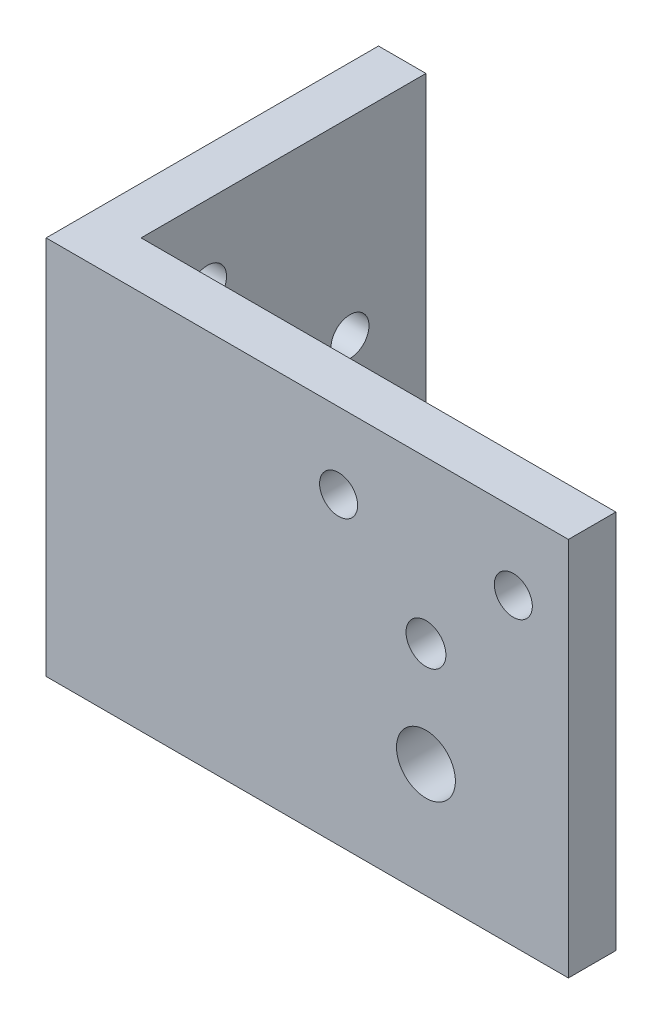
from build123d import *

# Parameters (mm, degrees)
BOSS_EXTRUDE2_DEPTH = 40
SKETCH3_R           = 3.1
SKETCH3_R_2         = 2.1
SKETCH3_R_3         = 2
CUT_EXTRUDE1_DEPTH  = 75.330343737
SKETCH4_R           = 2
CUT_EXTRUDE3_DEPTH  = 73.972597597


with BuildPart() as part:
    # Sketch1 → Boss-Extrude2 (new body)
    with BuildSketch(Plane(origin=(0, 0, 0), x_dir=(1, 0, 0), z_dir=(0, 1, 0))):
        Polygon((0, 0), (55, 0), (55, 5), (5, 5), (5, 35), (0, 35), align=None)
    extrude(amount=BOSS_EXTRUDE2_DEPTH)

    # Sketch3 → Cut-Extrude1 (cut, through all)
    with BuildSketch(Plane(origin=(0, 0, -5), x_dir=(-1, 0, 0), z_dir=(0, 0, -1))):
        with Locations((-40, 12)):
            Circle(SKETCH3_R)
        with Locations((-40, 23)):
            Circle(SKETCH3_R_2)
        with Locations((-49.2, 32)):
            Circle(SKETCH3_R_3)
        with Locations((-30.8, 32)):
            Circle(SKETCH3_R_3)
    extrude(amount=-CUT_EXTRUDE1_DEPTH, mode=Mode.SUBTRACT)

    # Sketch4 → Cut-Extrude3 (cut, through all)
    with BuildSketch(Plane(origin=(5, 0, 0), x_dir=(0, 0, -1), z_dir=(1, 0, 0))):
        with Locations((12, 32)):
            Circle(SKETCH4_R)
        with Locations((27, 20)):
            Circle(SKETCH4_R)
        with Locations((12, 8)):
            Circle(SKETCH4_R)
    extrude(amount=-CUT_EXTRUDE3_DEPTH, mode=Mode.SUBTRACT)


solid = part.part
